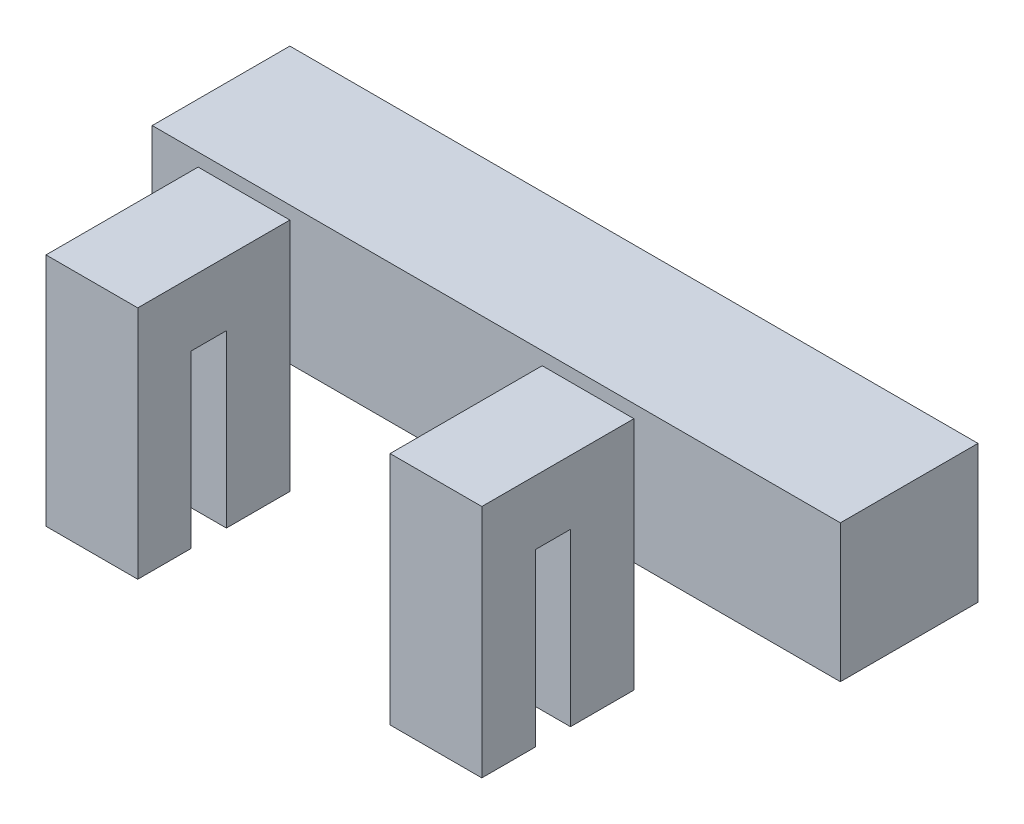
from build123d import *

# Parameters (mm, degrees)
ESQUISSE1_W                = 150
ESQUISSE1_H                = 30
BOSS_EXTRU_1_DEPTH         = 30
BOSS_EXTRU_2_START         = -10
BOSS_EXTRU_2_DEPTH         = 20
R_P_TITION_LIN_AIRE1_COUNT = 2
R_P_TITION_LIN_AIRE1_PITCH = 75


with BuildPart() as part:
    # Esquisse1 → Boss.-Extru.1 (new body)
    with BuildSketch(Plane.XY):
        with Locations((-75, 15)):
            Rectangle(ESQUISSE1_W, ESQUISSE1_H)
    extrude(amount=BOSS_EXTRU_1_DEPTH)

    # Esquisse2 → Boss.-Extru.2 (add)
    with BuildSketch(Plane.ZY.offset(150).offset(BOSS_EXTRU_2_START)):
        Polygon((30, 27.158170339), (63.156193336, 27.158170339), (63.156193336, -24.079833233), (51.504613428, -24.079833233), (51.504613428, 13.190748461), (43.833386904, 13.190748461), (43.833386904, -24.079833233), (30, -24.079833233), align=None)
    boss_extru_2 = extrude(amount=-BOSS_EXTRU_2_DEPTH)

    # Répétition linéaire1: Boss.-Extru.2 ×2
    with Locations(*[(i * R_P_TITION_LIN_AIRE1_PITCH, 0, 0) for i in range(1, R_P_TITION_LIN_AIRE1_COUNT)]):
        add(boss_extru_2)


solid = part.part
